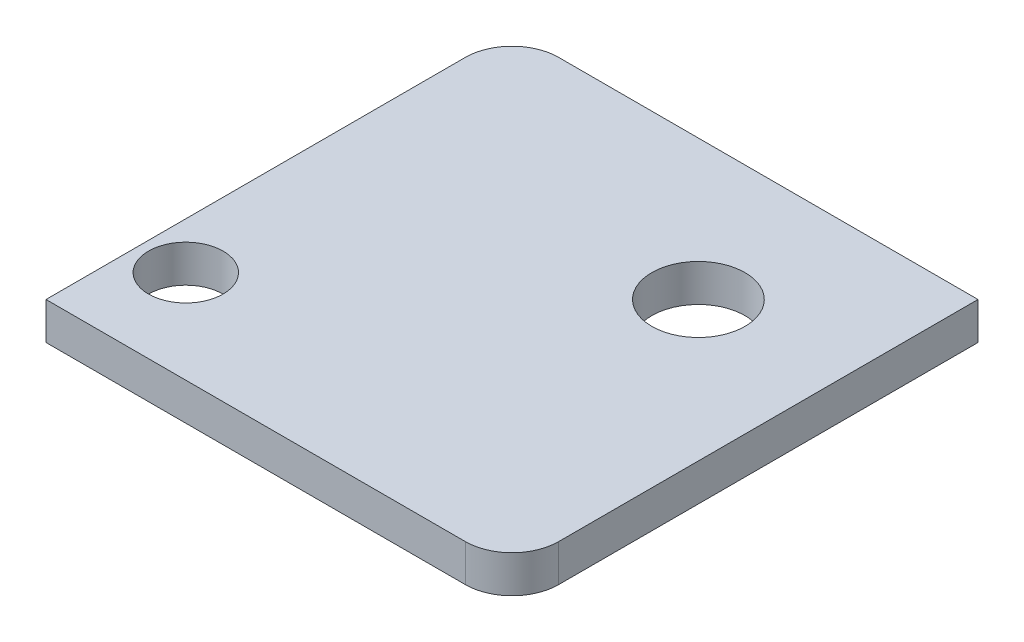
from build123d import *

# Parameters (mm, degrees)
SKETCH1_R           = 4
SKETCH1_R_2         = 5
BOSS_EXTRUDE1_DEPTH = 4


with BuildPart() as part:
    # Sketch1 → Boss-Extrude1 (new body)
    with BuildSketch(Plane(origin=(0, 0, 0), x_dir=(1, 0, 0), z_dir=(0, 1, 0))):
        with BuildLine():
            Line((0, 0), (0, 45))
            ThreePointArc((0, 45), (1.464466094, 48.535533906), (5, 50))
            Line((5, 50), (50, 50))
            Line((50, 50), (50, 5))
            ThreePointArc((50, 5), (48.535533906, 1.464466094), (45, 0))
            Line((45, 0), (0, 0))
        make_face()
        with Locations(Location((5, 10, 0), (0, 0, 270))):
            Circle(SKETCH1_R, mode=Mode.SUBTRACT)
        with Locations(Location((35, 35, 0), (0, 0, 270))):
            Circle(SKETCH1_R_2, mode=Mode.SUBTRACT)
    extrude(amount=BOSS_EXTRUDE1_DEPTH)


solid = part.part
